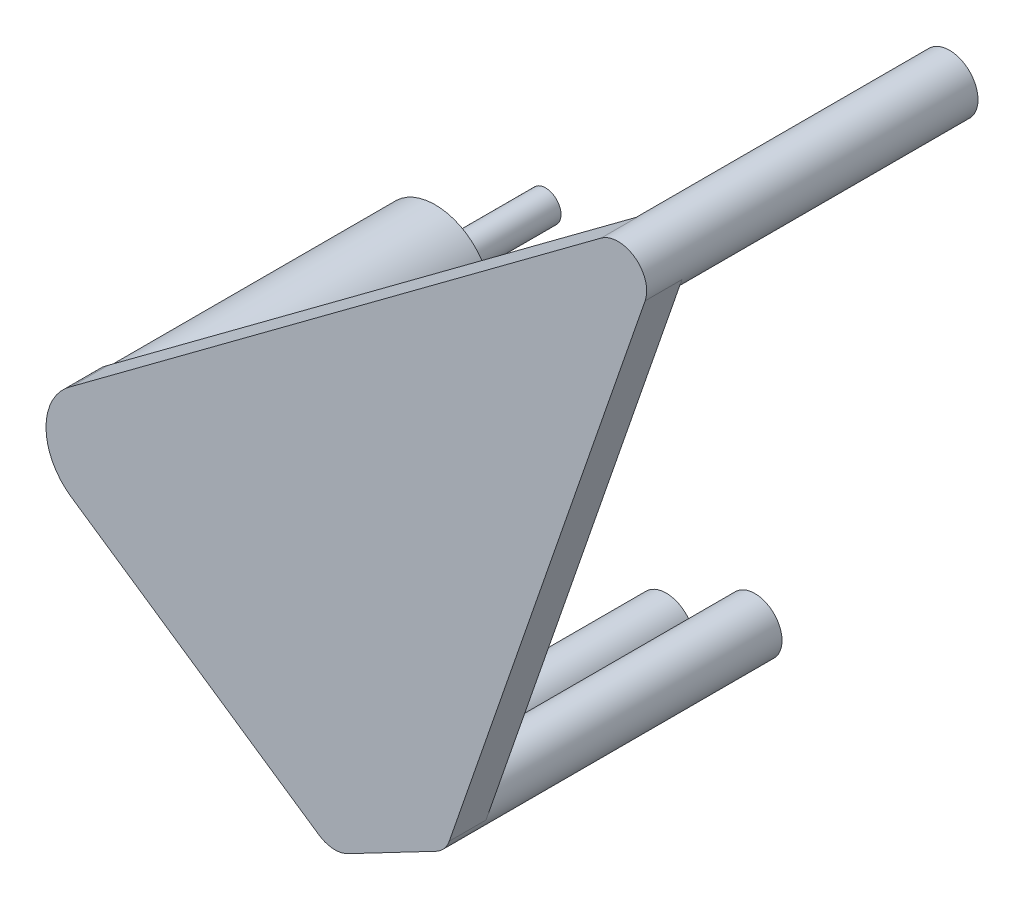
from build123d import *

# Parameters (mm, degrees)
SKETCH2_R             = 14.5
BOSS_EXTRUDE5_DEPTH   = 40.513
SKETCH2_R_2           = 7.343075537
BOSS_EXTRUDE5_2_DEPTH = 40.513
SKETCH2_R_3           = 7.048050761
BOSS_EXTRUDE5_3_DEPTH = 40.513
SKETCH2_R_4           = 7.405031705
BOSS_EXTRUDE5_4_DEPTH = 40.513
BOSS_EXTRUDE6_DEPTH   = 4.7625
SKETCH9_R             = 1.27
CUT_EXTRUDE2_DEPTH    = 9.525
SKETCH10_R            = 4
BOSS_EXTRUDE7_DEPTH   = 28.575


with BuildPart() as part:
    # Sketch2 → Boss-Extrude5 (new, symmetric)
    with BuildSketch(Plane.XY):
        with Locations((-135.989964622, 14.806967819)):
            Circle(SKETCH2_R)
    extrude(amount=BOSS_EXTRUDE5_DEPTH, both=True)



with BuildPart() as body_2:
    # Sketch2 → Boss-Extrude5 2 (new, symmetric)
    with BuildSketch(Plane.XY):
        with Locations((-76.175726851, -35.218198752)):
            Circle(SKETCH2_R_2)
    extrude(amount=BOSS_EXTRUDE5_2_DEPTH, both=True)


with BuildPart() as body_3:
    # Sketch2 → Boss-Extrude5 3 (new, symmetric)
    with BuildSketch(Plane.XY):
        with Locations((-53.236134933, -23.53725338)):
            Circle(SKETCH2_R_3)
    extrude(amount=BOSS_EXTRUDE5_3_DEPTH, both=True)


with BuildPart() as body_4:
    # Sketch2 → Boss-Extrude5 4 (new, symmetric)
    with BuildSketch(Plane.XY):
        with Locations((-2.84319901, 123.138021163)):
            Circle(SKETCH2_R_4)
    extrude(amount=BOSS_EXTRUDE5_4_DEPTH, both=True)


with BuildPart() as part_1:
    add(part.part)

    add(body_2.part)  # Boss-Extrude6 merges body 2

    add(body_3.part)  # Boss-Extrude6 merges body 3

    add(body_4.part)  # Boss-Extrude6 merges body 4
    # Sketch6 → Boss-Extrude6 (add, symmetric)
    with BuildSketch(Plane.XY.offset(40.513)):
        with BuildLine():
            Line((-144.43677034, 2.411344674), (-80.310762347, -41.286331891))
            ThreePointArc((-80.310762347, -41.286331891), (-76.600330476, -42.54898794), (-72.768932333, -41.723159126))
            Line((-72.768932333, -41.723159126), (-49.966216141, -29.780862162))
            ThreePointArc((-49.966216141, -29.780862162), (-47.894807622, -28.135648979), (-46.575803889, -25.842683907))
            Line((-46.575803889, -25.842683907), (4.15447513, 120.715821505))
            ThreePointArc((4.15447513, 120.715821505), (1.535064989, 129.110064273), (-7.258334859, 129.082856736))
            Line((-7.258334859, 129.082856736), (-144.43677034, 27.202590964))
            ThreePointArc((-144.43677034, 27.202590964), (-150.989964622, 14.806967819), (-144.43677034, 2.411344674))
        make_face()
    extrude(amount=BOSS_EXTRUDE6_DEPTH, both=True)

    # Sketch9 → Cut-Extrude2 (cut)
    with BuildSketch(Plane(origin=(0, 0, -40.513), x_dir=(-1, 0, 0), z_dir=(0, 0, -1))):
        with Locations((53.236134933, -23.53725338)):
            Circle(SKETCH9_R)
        with Locations((76.175726851, -35.218198752)):
            Circle(SKETCH9_R)
        with Locations((2.84319901, 123.138021163)):
            Circle(SKETCH9_R)
    extrude(amount=-CUT_EXTRUDE2_DEPTH, mode=Mode.SUBTRACT)

    # Sketch10 → Boss-Extrude7 (add)
    with BuildSketch(Plane(origin=(0, 0, -40.513), x_dir=(-1, 0, 0), z_dir=(0, 0, -1))):
        with Locations((135.989964622, 14.806967819)):
            Circle(SKETCH10_R)
    extrude(amount=BOSS_EXTRUDE7_DEPTH)


solid = part_1.part
